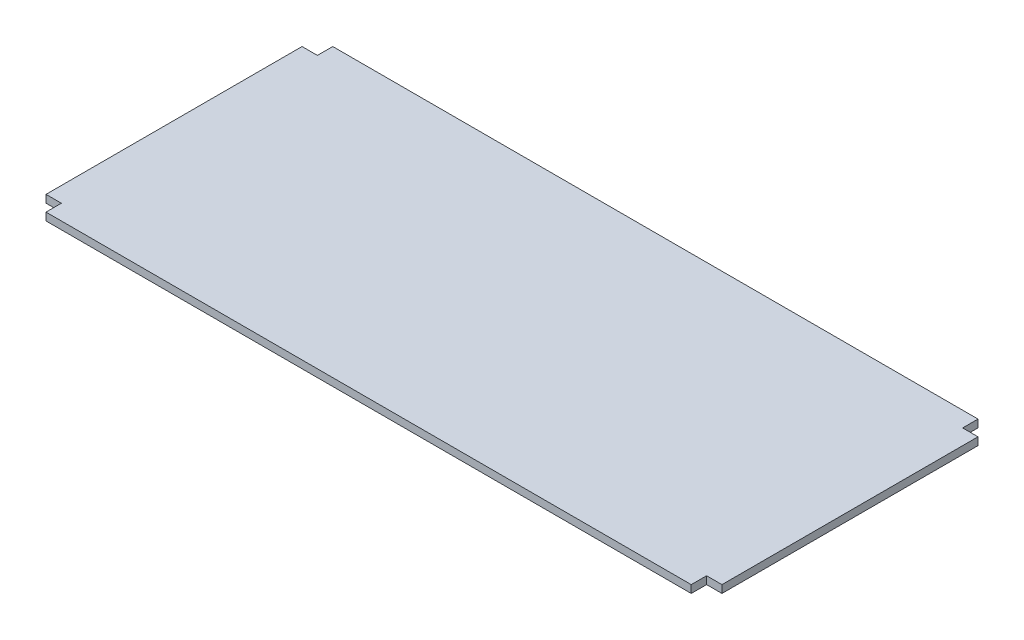
from build123d import *

# Parameters (mm, degrees)
BOSS_EXTRUDE1_DEPTH = 19.05


with BuildPart() as part:
    # Sketch1 → Boss-Extrude1 (new body)
    with BuildSketch(Plane(origin=(0, 0, 0), x_dir=(1, 0, 0), z_dir=(0, 1, 0))):
        Polygon((800.1, -355.6), (-800.1, -355.6), (-800.1, -317.5), (-838.2, -317.5), (-838.2, 317.5), (-800.1, 317.5), (-800.1, 355.6), (800.1, 355.6), (800.1, 317.5), (838.2, 317.5), (838.2, -317.5), (800.1, -317.5), align=None)
    extrude(amount=BOSS_EXTRUDE1_DEPTH)


solid = part.part
